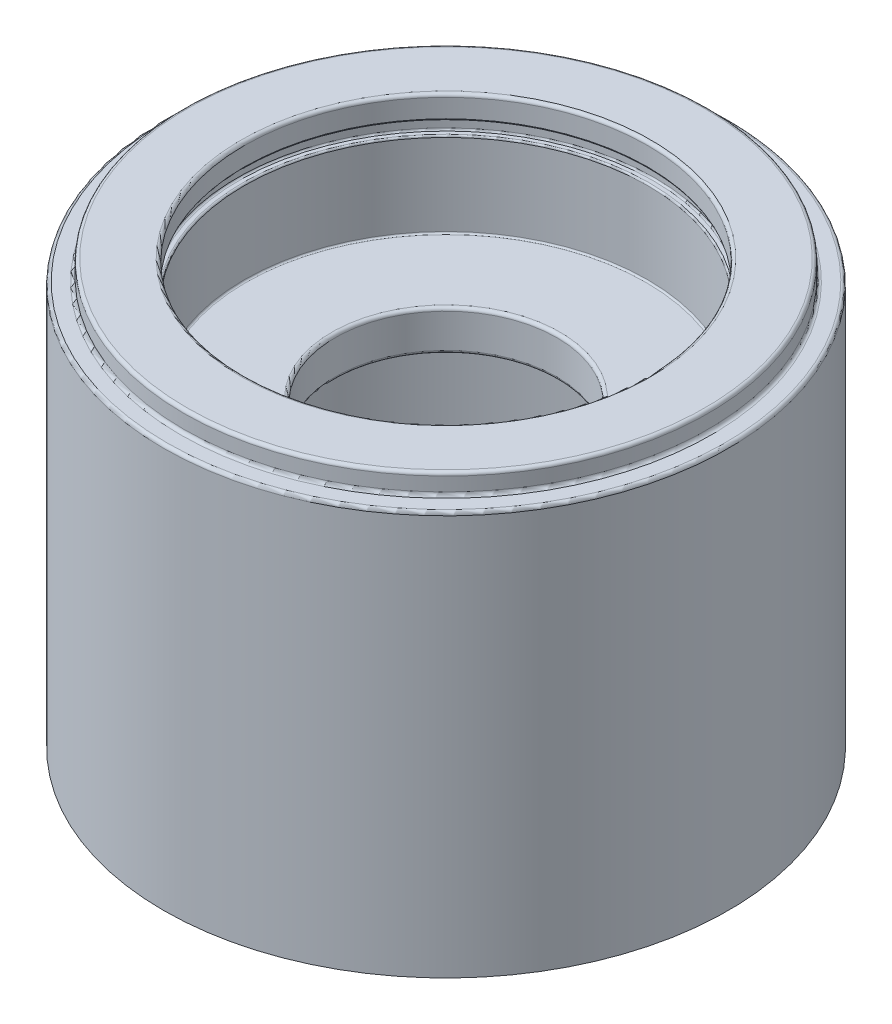
from build123d import *

# Parameters (mm, degrees)
SKETCH_1_R          = 70
SKETCH_1_R_2        = 65
EXTRUDE_1_DEPTH     = 105
EXTRUDE_START       = -40
SKETCH_2_R          = 65
SKETCH_2_R_2        = 27.5
EXTRUDE_2_DEPTH     = 40
CUT_EXTRUDE_START   = -30
SKETCH_3_R          = 50
SKETCH_3_R_2        = 27.5
CUT_EXTRUDE_2_DEPTH = 30
SKETCH_4_W          = 1.75
SKETCH_4_H          = 3.2
FILLET_2_R          = 0.4
FILLET_3_R          = 0.4
CUT_EXTRUDE_START_2 = -5
SKETCH_6_R          = 70
SKETCH_6_R_2        = 65
CUT_EXTRUDE_3_DEPTH = 5
FILLET_4_R          = 0.8
FILLET_5_R          = 0.8


with BuildPart() as part:
    # Эскиз1 → Бобышка-Вытянуть1 (new body)
    with BuildSketch(Plane(origin=(0, 0, 0), x_dir=(1, 0, 0), z_dir=(0, 1, 0))):
        with Locations(Location((0, 0, 0), (0, 0, 270))):
            Circle(SKETCH_1_R)
        with Locations(Location((0, 0, 0), (0, 0, 270))):
            Circle(SKETCH_1_R_2, mode=Mode.SUBTRACT)
    extrude(amount=EXTRUDE_1_DEPTH)

    # Эскиз2 → Бобышка-Вытянуть2 (add)
    with BuildSketch(Plane(origin=(0, 105, 0), x_dir=(1, 0, 0), z_dir=(0, 1, 0)).offset(EXTRUDE_START)):
        with Locations(Location((0, 0, 0), (0, 0, 270))):
            Circle(SKETCH_2_R)
        with Locations(Location((0, 0, 0), (0, 0, 270))):
            Circle(SKETCH_2_R_2, mode=Mode.SUBTRACT)
    extrude(amount=EXTRUDE_2_DEPTH)

    # Эскиз3 → Вырез-Вытянуть2 (cut)
    with BuildSketch(Plane(origin=(0, 105, 0), x_dir=(1, 0, 0), z_dir=(0, 1, 0)).offset(CUT_EXTRUDE_START)):
        with Locations(Location((0, 0, 0), (0, 0, 270))):
            Circle(SKETCH_3_R)
        with Locations(Location((0, 0, 0), (0, 0, 270))):
            Circle(SKETCH_3_R_2, mode=Mode.SUBTRACT)
    extrude(amount=CUT_EXTRUDE_2_DEPTH, mode=Mode.SUBTRACT)

    # Эскиз4 → Вырез-Повернуть1 (revolve, cut)
    with BuildSketch(Plane.XY, mode=Mode.PRIVATE) as cut_revolve_1_sk:
        with Locations((-50.875, 97.6)):
            Rectangle(SKETCH_4_W, SKETCH_4_H)
    revolve(cut_revolve_1_sk.sketch.rotate(Axis((0, 105, 0), (0, -1, 0)), 270), axis=Axis((0, 105, 0), (0, -1, 0)), mode=Mode.SUBTRACT)

    # Скругление2
    fillet_2_edges = [part.edges().sort_by_distance(p)[0] for p in [
        (0, 75, -50),
        (0, 99.2, -50),
        (0, 96, -51.75),
        (0, 96, -50),
    ]]
    fillet(fillet_2_edges, radius=FILLET_2_R)

    # Скругление3
    fillet_3_edges = [part.edges().sort_by_distance(p)[0] for p in [
        (0, 99.2, -51.75),
    ]]
    fillet(fillet_3_edges, radius=FILLET_3_R)

    # Эскиз6 → Вырез-Вытянуть3 (cut)
    with BuildSketch(Plane(origin=(0, 105, 0), x_dir=(1, 0, 0), z_dir=(0, 1, 0)).offset(CUT_EXTRUDE_START_2)):
        with Locations(Location((0, 0, 0), (0, 0, 270))):
            Circle(SKETCH_6_R)
        with Locations(Location((0, 0, 0), (0, 0, 270))):
            Circle(SKETCH_6_R_2, mode=Mode.SUBTRACT)
    extrude(amount=CUT_EXTRUDE_3_DEPTH, mode=Mode.SUBTRACT)

    # Скругление4
    fillet_4_edges = [part.edges().sort_by_distance(p)[0] for p in [
        (0, 105, -50),
        (0, 100, -70),
        (0, 100, -65),
        (0, 105, -65),
    ]]
    fillet(fillet_4_edges, radius=FILLET_4_R)

    # Скругление5
    fillet_5_edges = [part.edges().sort_by_distance(p)[0] for p in [
        (0, 65, -65),
        (0, 65, -27.5),
        (0, 75, -27.5),
    ]]
    fillet(fillet_5_edges, radius=FILLET_5_R)


solid = part.part
